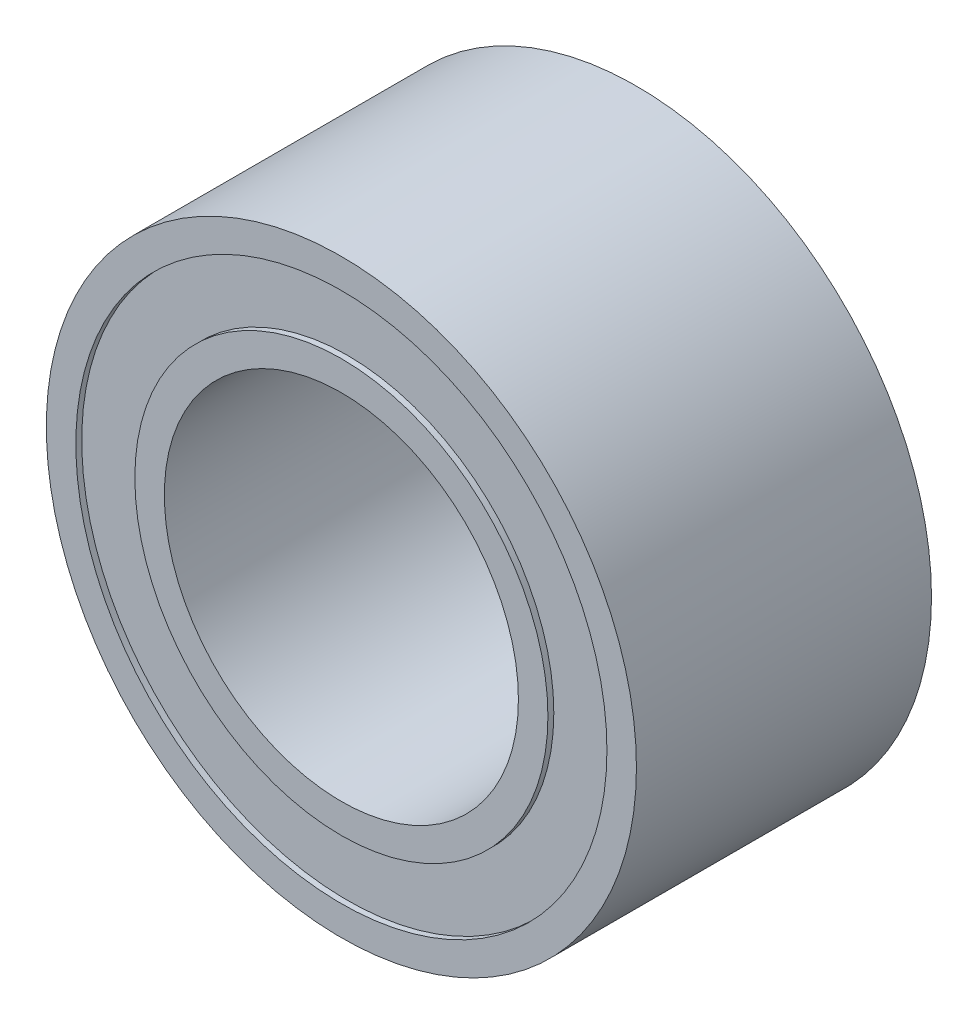
from build123d import *

# Parameters (mm, degrees)
SKETCH1_R           = 12.7
SKETCH1_R_2         = 7.62
BOSS_EXTRUDE1_DEPTH = 12.7
SKETCH2_R           = 11.43
SKETCH2_R_2         = 8.89
CUT_EXTRUDE1_DEPTH  = 0.254


with BuildPart() as part:
    # Sketch1 → Boss-Extrude1 (new body)
    with BuildSketch(Plane.XY):
        Circle(SKETCH1_R)
        Circle(SKETCH1_R_2, mode=Mode.SUBTRACT)
    extrude(amount=BOSS_EXTRUDE1_DEPTH)

    # Sketch2 → Cut-Extrude1 (cut)
    with BuildSketch(Plane.XY.offset(12.7)):
        Circle(SKETCH2_R)
        Circle(SKETCH2_R_2, mode=Mode.SUBTRACT)
    cut_extrude1 = extrude(amount=-CUT_EXTRUDE1_DEPTH, mode=Mode.SUBTRACT)

    # Mirror1: Cut-Extrude1 across plane
    add(cut_extrude1.mirror(Plane.XY.offset(6.35)), mode=Mode.SUBTRACT)


solid = part.part
